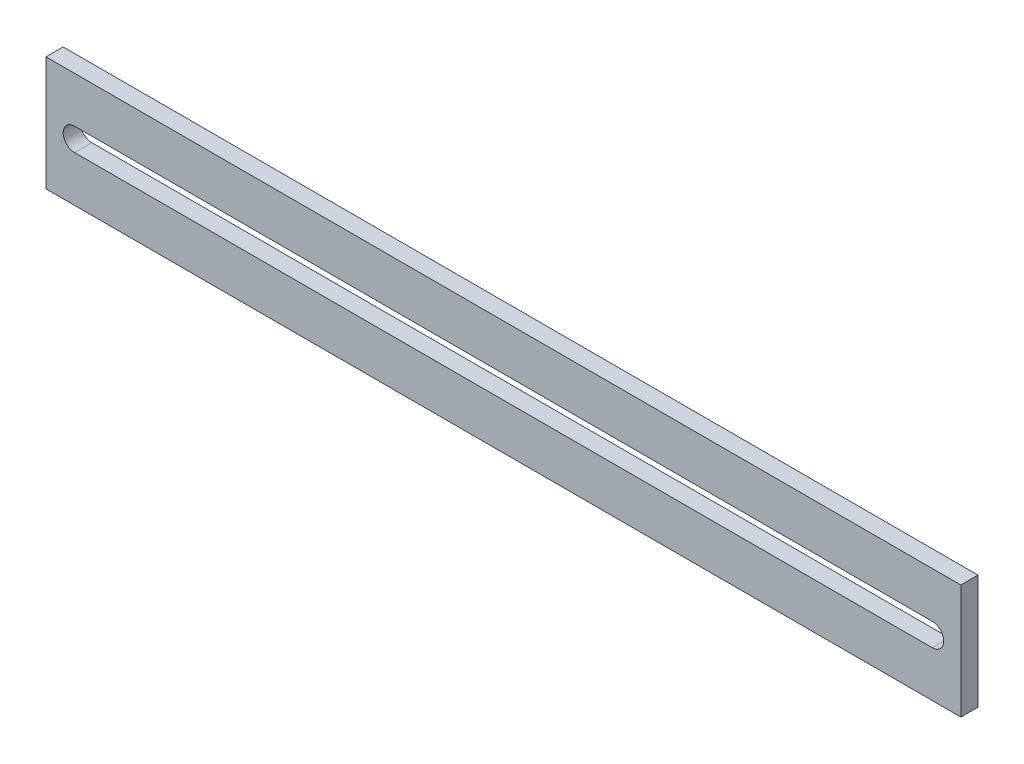
from build123d import *

# Parameters (mm, degrees)
SKETCH1_W           = 160
SKETCH1_H           = 20
BOSS_EXTRUDE1_DEPTH = 3
CUT_EXTRUDE1_DEPTH  = 3


with BuildPart() as part:
    # Sketch1 → Boss-Extrude1 (new body)
    with BuildSketch(Plane.XY):
        Rectangle(SKETCH1_W, SKETCH1_H)
    extrude(amount=BOSS_EXTRUDE1_DEPTH)

    # Sketch2 → Cut-Extrude1 (cut)
    with BuildSketch(Plane.XY.offset(3)):
        with BuildLine():
            Line((-75, 2), (75, 2))
            ThreePointArc((75, 2), (77, 0), (75, -2))
            Line((75, -2), (-75, -2))
            ThreePointArc((-75, -2), (-77, 0), (-75, 2))
        make_face()
    extrude(amount=-CUT_EXTRUDE1_DEPTH, mode=Mode.SUBTRACT)


solid = part.part
